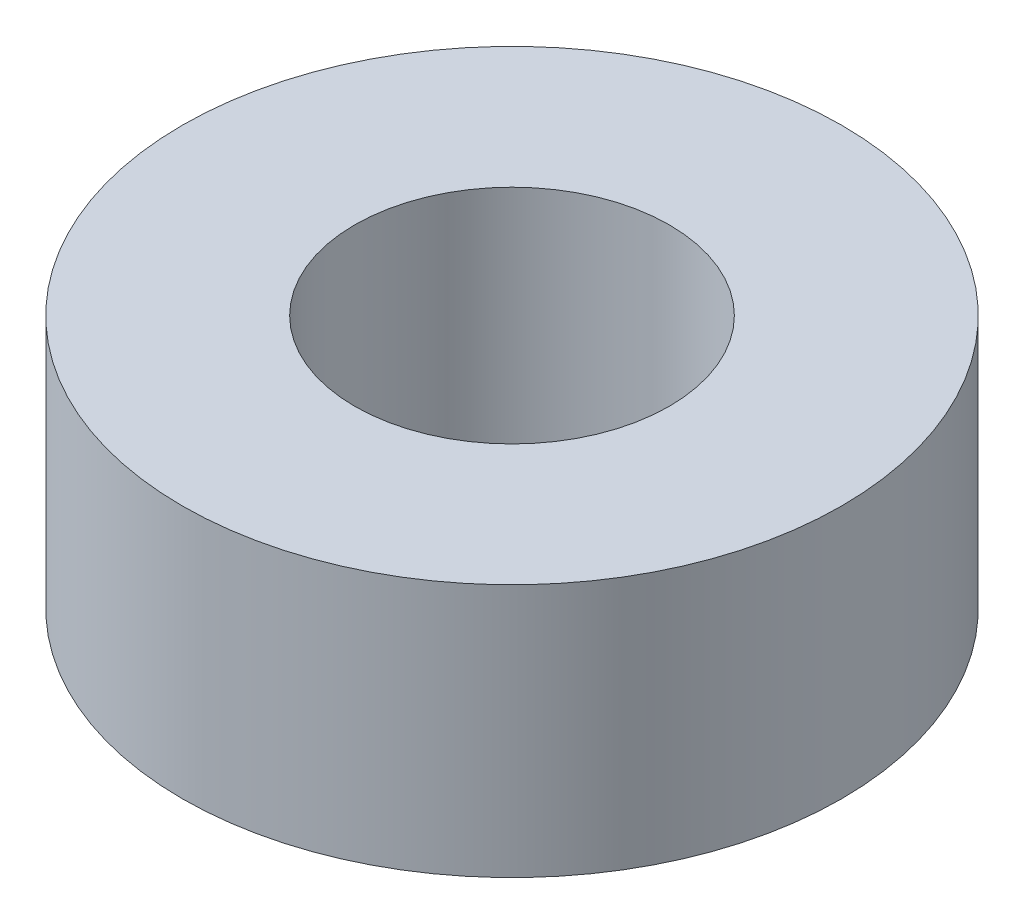
from build123d import *

# Parameters (mm, degrees)
SKETCH1_R           = 13
SKETCH1_R_2         = 6.2
BOSS_EXTRUDE1_DEPTH = 10


with BuildPart() as part:
    # Sketch1 → Boss-Extrude1 (new body)
    with BuildSketch(Plane(origin=(0, 0, 0), x_dir=(1, 0, 0), z_dir=(0, 1, 0))):
        with Locations(Location((0, 0, 0), (0, 0, 270))):
            Circle(SKETCH1_R)
        with Locations(Location((0, 0, 0), (0, 0, 270))):
            Circle(SKETCH1_R_2, mode=Mode.SUBTRACT)
    extrude(amount=BOSS_EXTRUDE1_DEPTH)


solid = part.part
